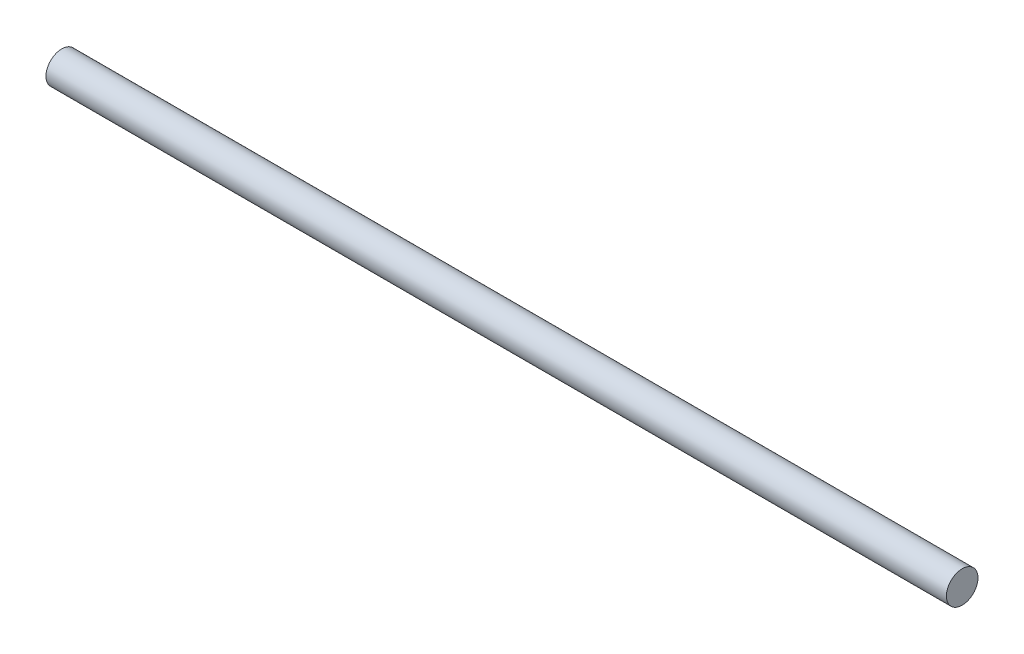
from build123d import *

# Parameters (mm, degrees)
SKETCH1_R           = 12.7
BOSS_EXTRUDE1_DEPTH = 723.9


with BuildPart() as part:
    # Sketch1 → Boss-Extrude1 (new body)
    with BuildSketch(Plane(origin=(0, 0, 0), x_dir=(0, 0, -1), z_dir=(1, 0, 0))):
        Circle(SKETCH1_R)
    extrude(amount=BOSS_EXTRUDE1_DEPTH)


solid = part.part
